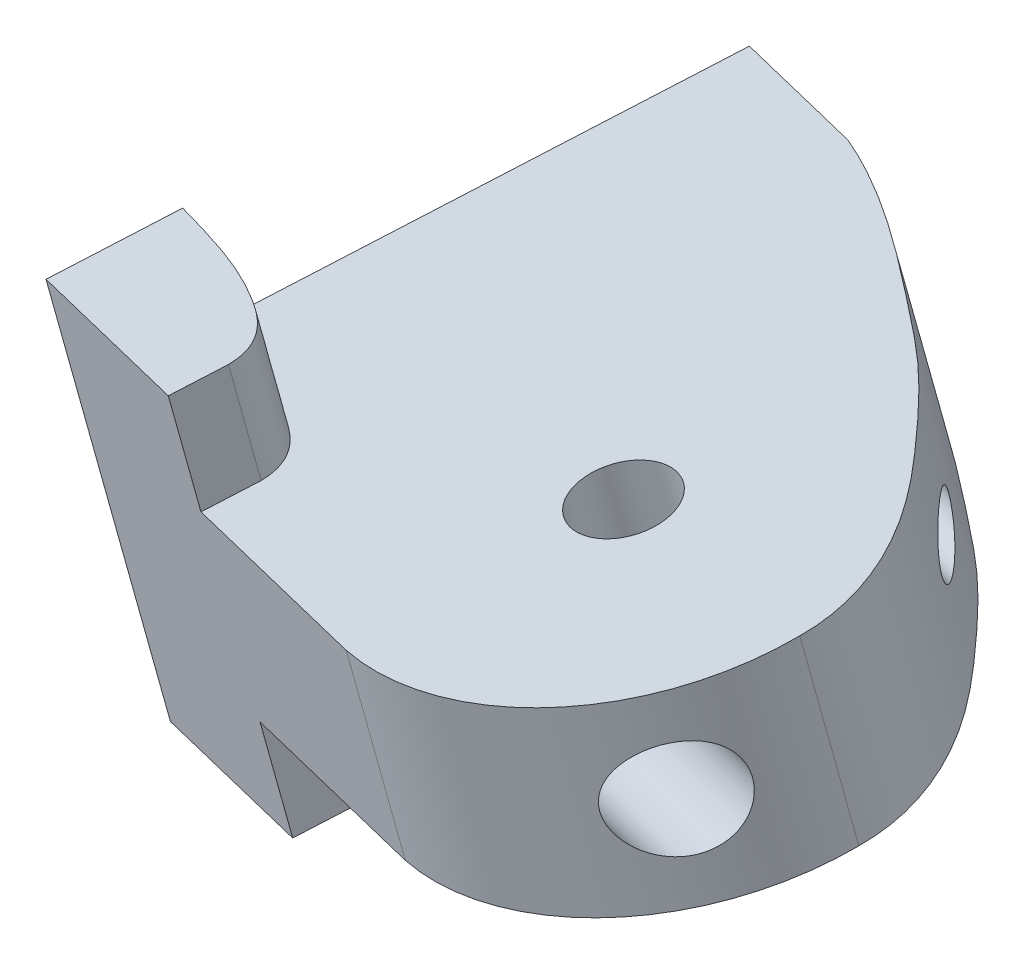
from build123d import *

# Parameters (mm, degrees)
SKETCH6_R               = 1.75
BOSS_EXTRUDE2_DEPTH     = 8
CUT_EXTRUDE4_DEPTH      = 107.173115528
CUT_EXTRUDE4_DEPTH_BACK = 107.173115528
CUT_EXTRUDE5_DEPTH      = 128.383624047
CUT_EXTRUDE5_DEPTH_BACK = 128.383624047
SKETCH8_R               = 1
SKETCH8_R_2             = 2
BOSS_EXTRUDE3_DEPTH     = 4.2
BOSS_EXTRUDE4_DEPTH     = 4.2


with BuildPart() as part:
    # Sketch6 → Boss-Extrude2 (new body)
    with BuildSketch(Plane(origin=(10.632574288, -81.095368055, -14.997352737), x_dir=(0.9917912583823046, 0.12573545426534224, 0.023252856537050268), z_dir=(-0.1278675087598277, 0.9752541956794009, 0.18035840433226386))):
        with BuildLine():
            Line((-58.720707619, -78.597122513), (-74.050825307, -74.287276551))
            Line((-74.050825307, -74.287276551), (-68.096662632, -53.10832599))
            Line((-68.096662632, -53.10832599), (-62.452093156, -54.695216936))
            add(Edge.make_bspline(
                [(-47.41282256, -71.448172315), (-46.98839964, -69.542379881), (-48.131042307, -66.495548615), (-50.899587461, -63.269699296), (-53.030599864, -61.025429488), (-55.421207388, -59.185223607), (-58.285739447, -56.985315978), (-60.74445703, -55.433736114), (-62.452093156, -54.695216936)],
                knots=[0, 0, 0, 0, 0.242004987, 0.382339127, 0.541586979, 0.632723015, 0.764707251, 1, 1, 1, 1], degree=3))
            ThreePointArc((-47.41282256, -71.448172315), (-51.536232304, -77.44357473), (-58.720707619, -78.597122513))
        make_face()
        with Locations(Location((-56.475493646, -69.630875245, 0), (0, 0, 270))):
            Circle(SKETCH6_R, mode=Mode.SUBTRACT)
    extrude(amount=BOSS_EXTRUDE2_DEPTH)

    # Sketch7 → Cut-Extrude4 (cut, two sides: drawn at the far end of the back side and taken through both)
    with BuildSketch(Plane(origin=(-24.575718662, -19.143853045, 86.09350443), x_dir=(0.9633013905822628, -0.058263627508971086, 0.26202248111903403), z_dir=(-0.2684221132885267, -0.20909392565369475, 0.9403346741200436)).offset(-CUT_EXTRUDE4_DEPTH_BACK)):
        Polygon((-40.726646112, -81.480078367), (-46.231379687, -82.217293899), (-46.664686567, -78.981823637), (-9.709847833, -74.032686551), (-9.276540953, -77.268156813), align=None)
        Polygon((-8.267725772, -84.80090478), (-39.717830931, -89.012826334), (-45.222564506, -89.750041866), (-44.789257627, -92.985512128), (-7.834418892, -88.036375042), align=None)
    extrude(amount=CUT_EXTRUDE4_DEPTH + CUT_EXTRUDE4_DEPTH_BACK, mode=Mode.SUBTRACT)

    # Sketch8 → Cut-Extrude5 (cut, two sides: drawn at the far end of the back side and taken through both)
    with BuildSketch(Plane(origin=(-48.867242553, -3.67618954, -14.766782297), x_dir=(-0.2877031657138141, -0.02164336093403552, 0.9574750405967399), z_dir=(-0.9547771830648638, -0.07182606814000152, -0.28851611156791795)).offset(-CUT_EXTRUDE5_DEPTH_BACK)):
        with Locations(Location((58.311594019, -91.780155744, 0), (0, 0, 1.243382016))):
            Circle(SKETCH8_R)
        with Locations(Location((69.605725243, -93.946396702, 0), (0, 0, 1.243382016))):
            Circle(SKETCH8_R_2)
    extrude(amount=CUT_EXTRUDE5_DEPTH + CUT_EXTRUDE5_DEPTH_BACK, mode=Mode.SUBTRACT)

    # Sketch9 → Boss-Extrude3 (add)
    with BuildSketch(Plane(origin=(9.63520772, -73.488385329, -13.590557183), x_dir=(0.9917912583823045, 0.12573545426534377, 0.023252856537050493), z_dir=(-0.12786750875982922, 0.9752541956794007, 0.18035840433226338))):
        with BuildLine():
            Line((-72.837409201, -69.971156701), (-74.050825307, -74.287276551))
            Line((-74.050825307, -74.287276551), (-67.043797112, -76.257203513))
            Line((-67.043797112, -76.257203513), (-66.509603126, -74.35707605))
            add(Edge.make_bspline(
                [(-66.509603126, -74.35707605), (-66.28129752, -73.149516128), (-68.619660453, -71.253742741), (-71.184936574, -70.487242661), (-72.837409201, -69.971156701)],
                knots=[0, 0, 0, 0, 0.375545962, 1, 1, 1, 1], degree=3))
        make_face()
    extrude(amount=BOSS_EXTRUDE3_DEPTH)

    # Sketch10 → Boss-Extrude4 (add)
    with BuildSketch(Plane(origin=(10.607000786, -80.900317216, -14.961281056), x_dir=(0.9917912583823054, 0.125735454265337, 0.023252856537049508), z_dir=(0.12786750875982242, -0.9752541956794013, -0.18035840433226552))):
        with BuildLine():
            Line((-67.043797112, 76.257203513), (-66.509603126, 74.35707605))
            add(Edge.make_bspline(
                [(-66.509603126, 74.35707605), (-66.370424117, 73.7937033), (-66.780315698, 72.705301804), (-68.402176626, 71.635929848), (-70.387506863, 70.717291368), (-72.029898632, 70.225000611), (-72.837409201, 69.971156701)],
                knots=[0, 0, 0, 0, 0.205424682, 0.379782812, 0.692407492, 1, 1, 1, 1], degree=3))
            Line((-72.837409201, 69.971156701), (-74.050825307, 74.287276551))
            Line((-74.050825307, 74.287276551), (-67.043797112, 76.257203513))
        make_face()
    extrude(amount=BOSS_EXTRUDE4_DEPTH)


solid = part.part
